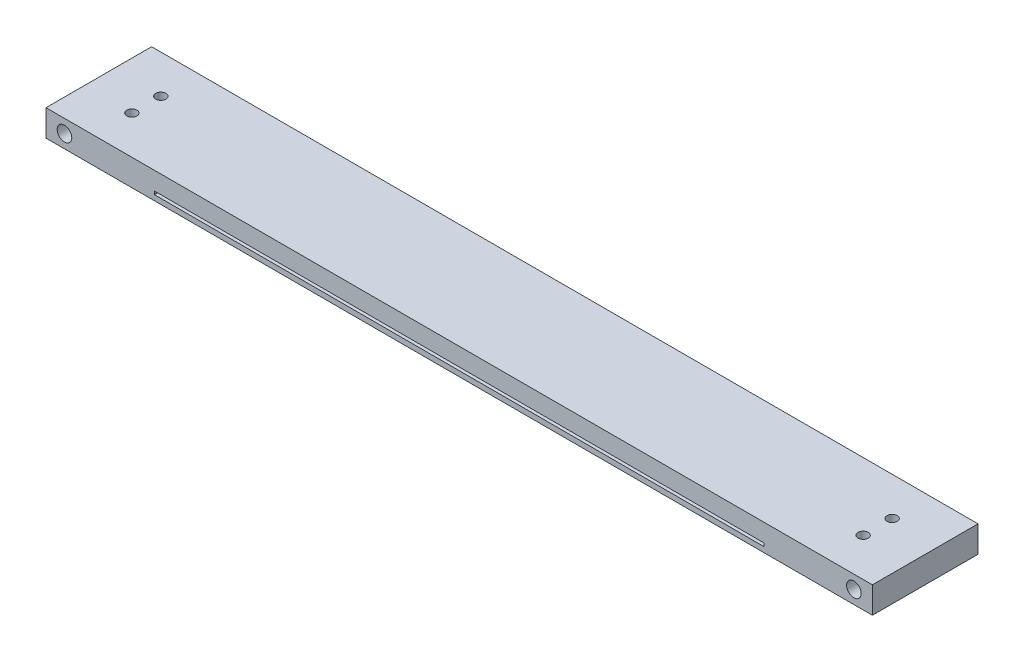
from build123d import *

# Parameters (mm, degrees)
SKETCH1_W           = 40
SKETCH1_H           = 10
BOSS_EXTRUDE1_DEPTH = 312.997959
SKETCH2_W           = 230.9
SKETCH2_H           = 1.2
CUT_EXTRUDE1_DEPTH  = 316.701951749
SKETCH3_R           = 1.9177
CUT_EXTRUDE2_DEPTH  = 316.701951749
CUT_EXTRUDE3_DEPTH  = 4.3
SKETCH5_R           = 2.762258299
CUT_EXTRUDE4_DEPTH  = 316.701951749
SKETCH6_W           = 3.15468
SKETCH6_H           = 6.8326
CUT_EXTRUDE5_DEPTH  = 15


with BuildPart() as part:
    # Sketch1 → Boss-Extrude1 (new body)
    with BuildSketch(Plane(origin=(0, 0, 0), x_dir=(0, 0, -1), z_dir=(1, 0, 0))):
        with Locations((20, 5)):
            Rectangle(SKETCH1_W, SKETCH1_H)
    extrude(amount=BOSS_EXTRUDE1_DEPTH)

    # Sketch2 → Cut-Extrude1 (cut, through all)
    with BuildSketch(Plane(origin=(0, 0, -40), x_dir=(-1, 0, 0), z_dir=(0, 0, -1))):
        with Locations((-156.4989795, 2.6)):
            Rectangle(SKETCH2_W, SKETCH2_H)
    extrude(amount=-CUT_EXTRUDE1_DEPTH, mode=Mode.SUBTRACT)

    # Sketch3 → Cut-Extrude2 (cut, through all)
    with BuildSketch(Plane(origin=(0, 10, 0), x_dir=(1, 0, 0), z_dir=(0, 1, 0))):
        with Locations(Location((294.997959, 25.5, 0), (0, 0, 270))):
            Circle(SKETCH3_R)
        with Locations(Location((294.997959, 14.5, 0), (0, 0, 270))):
            Circle(SKETCH3_R)
        with Locations(Location((18, 14.5, 0), (0, 0, 90))):
            Circle(SKETCH3_R)
        with Locations(Location((18, 25.5, 0), (0, 0, 90))):
            Circle(SKETCH3_R)
    extrude(amount=-CUT_EXTRUDE2_DEPTH, mode=Mode.SUBTRACT)

    # Sketch4 → Cut-Extrude3 (cut)
    with BuildSketch(Plane.XZ):
        Polygon((14.5837, -12.527598275), (14.5837, -16.472401725), (18, -18.444803449), (21.4163, -16.472401725), (21.4163, -12.527598275), (18, -10.555196551), align=None)
        Polygon((14.5837, -23.527598275), (14.5837, -27.472401725), (18, -29.444803449), (21.4163, -27.472401725), (21.4163, -23.527598275), (18, -21.555196551), align=None)
        Polygon((298.414259, -12.527598275), (294.997959, -10.555196551), (291.581659, -12.527598275), (291.581659, -16.472401725), (294.997959, -18.444803449), (298.414259, -16.472401725), align=None)
        Polygon((291.581659, -23.527598275), (291.581659, -27.472401725), (294.997959, -29.444803449), (298.414259, -27.472401725), (298.414259, -23.527598275), (294.997959, -21.555196551), align=None)
    extrude(amount=-CUT_EXTRUDE3_DEPTH, mode=Mode.SUBTRACT)

    # Sketch5 → Cut-Extrude4 (cut, through all)
    with BuildSketch(Plane.XY):
        with Locations((7, 5)):
            Circle(SKETCH5_R)
        with Locations(Location((305.997959, 5, 0), (0, 0, 180))):
            Circle(SKETCH5_R)
    extrude(amount=-CUT_EXTRUDE4_DEPTH, mode=Mode.SUBTRACT)

    # Sketch6 → Cut-Extrude5 (cut)
    with BuildSketch(Plane.ZY):
        with Locations((-31.42266, 5)):
            Rectangle(SKETCH6_W, SKETCH6_H)
        with Locations((-8.57734, 5)):
            Rectangle(SKETCH6_W, SKETCH6_H)
    extrude(amount=-CUT_EXTRUDE5_DEPTH, mode=Mode.SUBTRACT)


solid = part.part
